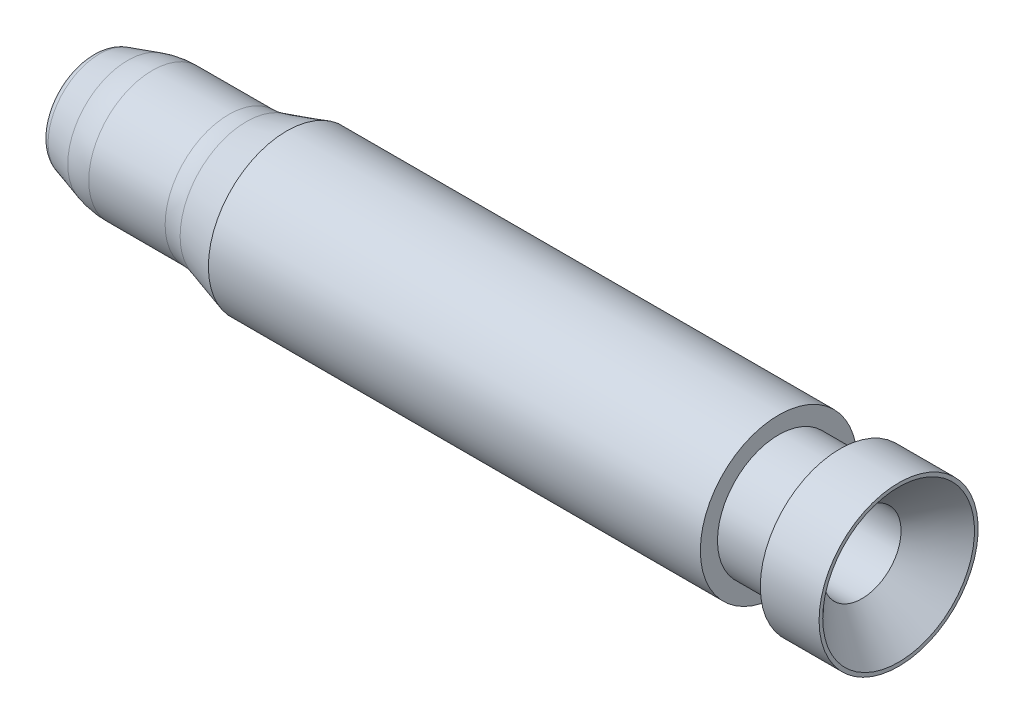
from build123d import *

# Parameters (mm, degrees)
FILETE2_R     = 7
FILETE3_R     = 5
CHANFRO1_SIZE = 3
FILETE6_R     = 1


with BuildPart() as part:
    # Esboço1 → Revolução1 (revolve)
    with BuildSketch(Plane(origin=(0, 0, 0), x_dir=(1, 0, 0), z_dir=(0, 1, 0)), mode=Mode.PRIVATE) as revolu_o1_sk:
        Polygon((0.000828852, 3.2), (66, 3.2), (66, 6.5), (61.2, 6.5), (61.2, 5), (56.2, 5), (56.2, 6.4), (16.000828852, 6.4), (12.000828852, 5.2), (4.000828852, 5.2), (0.000828852, 4), align=None)
    revolve(revolu_o1_sk.sketch.rotate(Axis((0, 0, 0), (1, 0, 0)), 180), axis=Axis((0, 0, 0), (1, 0, 0)))

    # Filete2
    filete2_edges = [part.edges().sort_by_distance(p)[0] for p in [
        (4.000828852, 0, -5.2),
    ]]
    fillet(filete2_edges, radius=FILETE2_R)

    # Filete3
    filete3_edges = [part.edges().sort_by_distance(p)[0] for p in [
        (12.000828852, 0, -5.2),
    ]]
    fillet(filete3_edges, radius=FILETE3_R)

    # Chanfro1
    chanfro1_edges = [part.edges().sort_by_distance(p)[0] for p in [
        (66, 0, -3.2),
    ]]
    chamfer(chanfro1_edges, length=CHANFRO1_SIZE)

    # Filete6
    filete6_edges = [part.edges().sort_by_distance(p)[0] for p in [
        (0.000828852, 0, -4),
    ]]
    fillet(filete6_edges, radius=FILETE6_R)


solid = part.part
